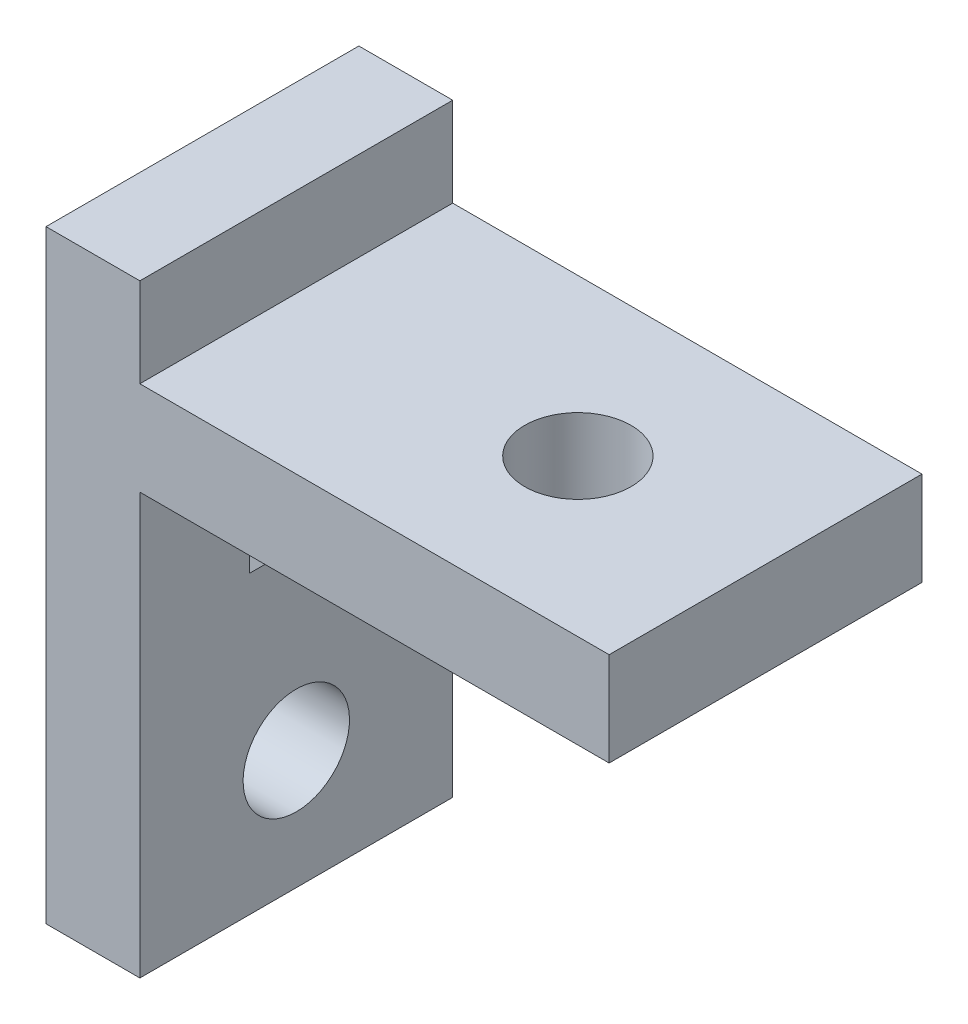
from build123d import *

# Parameters (mm, degrees)
BOSS_EXTRUDE1_DEPTH = 5
SKETCH2_R           = 1.7
CUT_EXTRUDE1_DEPTH  = 25.891815924
SKETCH3_R           = 1.7
CUT_EXTRUDE2_DEPTH  = 24.019611204
SKETCH5_W           = 3
SKETCH5_H           = 2.85
BOSS_EXTRUDE2_DEPTH = 10
BOSS_EXTRUDE3_DEPTH = 1.5


with BuildPart() as part:
    # Sketch1 → Boss-Extrude1 (new, symmetric)
    with BuildSketch(Plane.XY):
        Polygon((0, 0), (3, 0), (3, 13.45), (18, 13.45), (18, 16.45), (0, 16.45), align=None)
    extrude(amount=BOSS_EXTRUDE1_DEPTH, both=True)

    # Sketch2 → Cut-Extrude1 (cut, through all)
    with BuildSketch(Plane.ZY):
        with Locations(Location((0, 3.8, 0), (0, 0, 270))):
            Circle(SKETCH2_R)
    extrude(amount=-CUT_EXTRUDE1_DEPTH, mode=Mode.SUBTRACT)

    # Sketch3 → Cut-Extrude2 (cut, through all)
    with BuildSketch(Plane.XZ.offset(-13.45)):
        with Locations(Location((12, 0, 0), (0, 0, 270))):
            Circle(SKETCH3_R)
    extrude(amount=-CUT_EXTRUDE2_DEPTH, mode=Mode.SUBTRACT)

    # Sketch5 → Boss-Extrude2 (add)
    with BuildSketch(Plane.XY.offset(5)):
        with Locations((1.5, 17.875)):
            Rectangle(SKETCH5_W, SKETCH5_H)
    extrude(amount=-BOSS_EXTRUDE2_DEPTH)

    # Sketch6 → Boss-Extrude3 (add, symmetric)
    with BuildSketch(Plane.XY):
        Polygon((7, 13.45), (3, 9.45), (3, 13.45), align=None)
    extrude(amount=BOSS_EXTRUDE3_DEPTH, both=True)


solid = part.part
